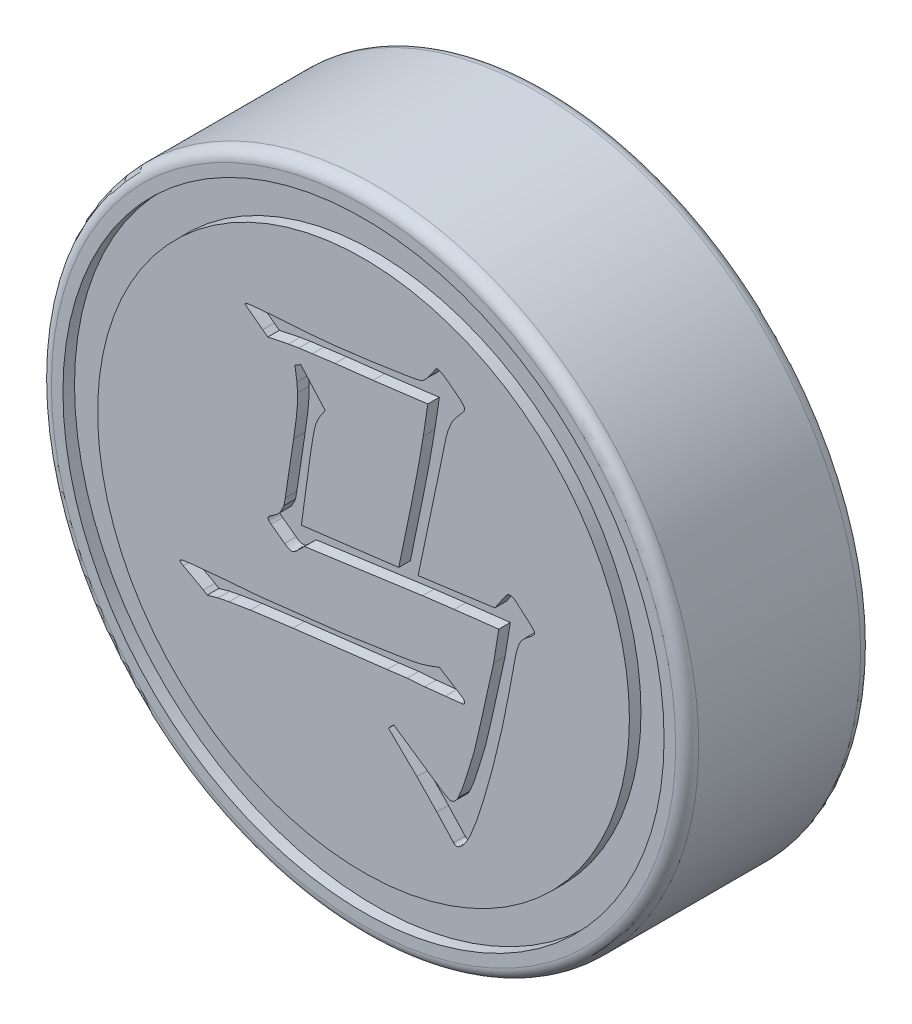
from build123d import *

# Parameters (mm, degrees)
SKETCH_1_R          = 14
EXTRUDE_1_DEPTH     = 8
SKETCH_2_R          = 13
SKETCH_2_R_2        = 11.5
CUT_EXTRUDE_1_DEPTH = 0.5
SKETCH_3_R          = 5.1
CUT_EXTRUDE_2_DEPTH = 5
CHAMFER_1_SIZE      = 0.5
FILLET_1_R          = 0.5
CUT_EXTRUDE_3_DEPTH = 0.5


with BuildPart() as part:
    # 草图1 → 凸台-拉伸1 (new body)
    with BuildSketch(Plane.XY):
        Circle(SKETCH_1_R)
    extrude(amount=EXTRUDE_1_DEPTH)

    # 草图2 → 切除-拉伸1 (cut)
    with BuildSketch(Plane.XY.offset(8)):
        Circle(SKETCH_2_R)
        Circle(SKETCH_2_R_2, mode=Mode.SUBTRACT)
    extrude(amount=-CUT_EXTRUDE_1_DEPTH, mode=Mode.SUBTRACT)

    # 草图3 → 切除-拉伸2 (cut)
    with BuildSketch(Plane(origin=(0, 0, 0), x_dir=(-1, 0, 0), z_dir=(0, 0, -1))):
        Circle(SKETCH_3_R)
    extrude(amount=-CUT_EXTRUDE_2_DEPTH, mode=Mode.SUBTRACT)

    # 倒角1
    chamfer_1_edges = [part.edges().sort_by_distance(p)[0] for p in [
        (5.1, 0, 0),
    ]]
    chamfer(chamfer_1_edges, length=CHAMFER_1_SIZE)

    # 圆角1
    fillet_1_edges = [part.edges().sort_by_distance(p)[0] for p in [
        (-14, 0, 0),
        (-14, 0, 8),
    ]]
    fillet(fillet_1_edges, radius=FILLET_1_R)

    # 草图4 → 切除-拉伸3 (cut)
    with BuildSketch(Plane.XY.offset(8)):
        with BuildLine():
            Line((1.02192811, -3.388258753), (-3.05009405, -3.875793379))
            Line((-3.05009405, -3.875793379), (-4.889429231, -4.119560692))
            Line((-4.889429231, -4.119560692), (-5.811866904, -4.26914518))
            Line((-5.811866904, -4.26914518), (-6.285551114, -4.360557922))
            Line((-6.285551114, -4.360557922), (-6.759235325, -4.493521911))
            Line((-6.759235325, -4.493521911), (-6.928210394, -4.379948504))
            Line((-6.928210394, -4.379948504), (-7.792476322, -3.91180446))
            add(Edge.make_bspline(
                [(-7.792476322, -3.91180446), (-7.824172033, -3.892915726), (-7.874332496, -3.863023113), (-7.941986755, -3.812928981), (-7.92754592, -3.743671449), (-7.860134953, -3.72568963), (-7.777743835, -3.704399275), (-7.656142427, -3.691861261), (-7.488248367, -3.667681472), (-7.270030835, -3.643344867), (-7.00294079, -3.620030117), (-6.687325402, -3.58826599), (-6.32163013, -3.555561773), (-6.061182151, -3.533144655), (-5.922670228, -3.521222742)],
                knots=[0, 0, 0, 0, 0.611781, 0.96818203, 1.194559333, 1.578472039, 1.958946652, 2.601457746, 3.511911509, 4.688574786, 6.115484087, 7.810376802, 9.771866877, 12, 12, 12, 12], degree=3))
            Line((-5.922670228, -3.521222742), (-4.498847513, -3.407649335))
            Line((-4.498847513, -3.407649335), (-3.385274106, -3.277455429))
            Line((-3.385274106, -3.277455429), (-0.928210394, -2.997677036))
            Line((-0.928210394, -2.997677036), (-0.177517873, -2.884103629))
            add(Edge.make_bspline(
                [(-0.177517873, -2.884103629), (-0.002976659, -2.859355952), (0.326844228, -2.812591634), (0.792296954, -2.743770847), (1.200132677, -2.679089227), (1.551111094, -2.624329555), (1.845573951, -2.576664554), (2.083214985, -2.538979277), (2.263557865, -2.506833925), (2.4302683, -2.469309808), (2.606257464, -2.417566126), (2.818816594, -2.352225825), (3.044790218, -2.26724903), (3.201125616, -2.206507502), (3.282315922, -2.174962355)],
                knots=[0, 0, 0, 0, 1.791337178, 3.384990876, 4.781030563, 5.98732094, 6.994598224, 7.812133823, 8.432316449, 8.855683894, 9.547782439, 10.29557961, 11.114836339, 12, 12, 12, 12], degree=3))
            Line((3.282315922, -2.174962355), (4.232454426, -2.773300305))
            add(Edge.make_bspline(
                [(4.232454426, -2.773300305), (4.271524145, -2.800024142), (4.338583314, -2.845892871), (4.376092197, -2.938865362), (4.367253378, -3.000808926), (4.336229229, -3.032922899), (4.289742694, -3.051756492), (4.252983665, -3.052604886), (4.232454426, -3.053078698)],
                knots=[0, 0, 0, 0, 1.952119358, 3.350612848, 3.943943387, 4.465772206, 5.143162068, 6, 6, 6, 6], degree=3))
            Line((4.232454426, -3.053078698), (3.534393484, -3.127870942))
            Line((3.534393484, -3.127870942), (2.642426725, -3.222053767))
            Line((2.642426725, -3.222053767), (1.888964121, -3.277455429))
            Line((1.888964121, -3.277455429), (1.02192811, -3.388258753))
        make_face()
        with BuildLine():
            Line((1.080099855, -5.557233823), (1.301706504, -5.316236593))
            Line((1.301706504, -5.316236593), (2.864033373, -6.379948504))
            add(Edge.make_bspline(
                [(2.864033373, -6.379948504), (2.921232846, -6.420645143), (3.029775317, -6.497871619), (3.184138411, -6.606115645), (3.322348227, -6.698115685), (3.44450176, -6.772047064), (3.546233052, -6.833226302), (3.630160245, -6.880434039), (3.698682589, -6.906876853), (3.765605144, -6.929272156), (3.846166712, -6.918855314), (3.933253227, -6.867195385), (4.018005703, -6.779226826), (4.065015406, -6.704235723), (4.091180188, -6.662496981)],
                knots=[0, 0, 0, 0, 1.690601399, 3.208107423, 4.540290873, 5.688248642, 6.645475806, 7.401535736, 8.000286814, 8.415709317, 9.086148281, 9.872346963, 10.815785381, 12, 12, 12, 12], degree=3))
            add(Edge.make_bspline(
                [(4.091180188, -6.662496981), (4.117627662, -6.60550354), (4.178295318, -6.474766724), (4.265775778, -6.244966076), (4.3640889, -5.958148986), (4.468193231, -5.632404311), (4.569344843, -5.308806316), (4.6586903, -5.026766459), (4.725968492, -4.805352682), (4.76890813, -4.648891954), (4.80181246, -4.523434584), (4.830259269, -4.394371325), (4.873997524, -4.224298078), (4.922523562, -4.011597842), (4.981078932, -3.756839815), (5.0470315, -3.459187473), (5.124780675, -3.120565687), (5.207925826, -2.753077147), (5.289885259, -2.385320588), (5.368076469, -2.044953086), (5.435286584, -1.7450102), (5.489371401, -1.485983217), (5.536778291, -1.268141042), (5.576868413, -1.091322595), (5.603152124, -0.9541783), (5.619275602, -0.876702943), (5.625806227, -0.845322465)],
                knots=[0, 0, 0, 0, 0.750612739, 1.721824789, 2.936128122, 4.373724398, 5.807971754, 6.987489208, 7.909046822, 8.572902297, 8.926151498, 9.458746659, 10.151849687, 11.024345739, 12.065550674, 13.275485001, 14.667344146, 16.217169633, 17.777758605, 19.16961775, 20.390320618, 21.450699861, 22.331528071, 23.054379614, 23.616987649, 24, 24, 24, 24], degree=3))
            Line((5.625806227, -0.845322465), (5.850182958, 0.536949003))
            Line((5.850182958, 0.536949003), (3.924975202, 0.312572272))
            Line((3.924975202, 0.312572272), (2.556554149, 0.143597202))
            Line((2.556554149, 0.143597202), (-2.548709009, -0.565544072))
            Line((-2.548709009, -0.565544072), (-2.908819812, -0.920114709))
            add(Edge.make_bspline(
                [(-2.908819812, -0.920114709), (-2.941890259, -0.948939537), (-3.00586781, -1.004703581), (-3.140264264, -1.023385851), (-3.281555703, -0.980765103), (-3.365867073, -0.918752404), (-3.412974937, -0.884103629)],
                knots=[0, 0, 0, 0, 0.919078809, 1.778034959, 2.758506399, 4, 4, 4, 4], degree=3))
            Line((-3.412974937, -0.884103629), (-3.997462472, -0.454740748))
            add(Edge.make_bspline(
                [(-3.997462472, -0.454740748), (-4.028880439, -0.431307008), (-4.08409245, -0.39012599), (-4.130150416, -0.312795575), (-4.121880376, -0.24586378), (-4.083885947, -0.196489553), (-4.022207428, -0.14619973), (-3.971207955, -0.115147153), (-3.942060809, -0.097400028)],
                knots=[0, 0, 0, 0, 1.441121206, 2.532538105, 3.079035341, 3.812238323, 4.74965357, 6, 6, 6, 6], degree=3))
            add(Edge.make_bspline(
                [(-3.942060809, -0.097400028), (-3.898933282, -0.070622681), (-3.818398472, -0.020619617), (-3.714185048, 0.063741102), (-3.632320197, 0.147021927), (-3.565108397, 0.258807023), (-3.50709492, 0.382699935), (-3.461112743, 0.476062866), (-3.440675768, 0.517558421)],
                knots=[0, 0, 0, 0, 1.123788134, 2.098521925, 2.967174611, 3.693826349, 4.975011237, 6, 6, 6, 6], degree=3))
            Line((-3.440675768, 0.517558421), (-3.385274106, 0.836117978))
            Line((-3.385274106, 0.836117978), (-3.022393219, 3.229469778))
            add(Edge.make_bspline(
                [(-3.022393219, 3.229469778), (-3.00412643, 3.342940479), (-2.970021424, 3.554795926), (-2.933005496, 3.851718927), (-2.900923847, 4.102613135), (-2.875597693, 4.375920415), (-2.85545411, 4.684369894), (-2.854092918, 4.924725476), (-2.85341815, 5.043874211)],
                knots=[0, 0, 0, 0, 1.13380918, 2.116878191, 2.951914959, 3.629057972, 4.82467991, 6, 6, 6, 6], degree=3))
            add(Edge.make_bspline(
                [(-2.85341815, 5.043874211), (-2.857221579, 5.089110723), (-2.864205398, 5.172173558), (-2.872032281, 5.283011949), (-2.878322445, 5.36884719), (-2.880287978, 5.416906942), (-2.881118981, 5.437226011)],
                knots=[0, 0, 0, 0, 1.381352456, 2.536425719, 3.381218889, 4, 4, 4, 4], degree=3))
            Line((-2.881118981, 5.437226011), (-2.966991557, 6.01617338))
            Line((-2.966991557, 6.01617338), (-2.714913995, 6.165757867))
            Line((-2.714913995, 6.165757867), (-1.653972167, 4.969081967))
            add(Edge.make_bspline(
                [(-1.653972167, 4.969081967), (-1.698327178, 4.91158838), (-1.783539262, 4.801135282), (-1.891320703, 4.630740179), (-1.981542932, 4.467955633), (-2.054696531, 4.294917185), (-2.115792442, 4.081378367), (-2.168540935, 3.797720377), (-2.238526564, 3.431222604), (-2.275949519, 3.156770155), (-2.296631447, 3.005093047)],
                knots=[0, 0, 0, 0, 0.829490091, 1.593564684, 2.301893073, 2.954577079, 3.735947138, 4.834958111, 6.250828513, 8, 8, 8, 8], degree=3))
            Line((-2.296631447, 3.005093047), (-2.687213164, 0.162987784))
            Line((-2.687213164, 0.162987784), (1.526083235, 0.68653349))
            add(Edge.make_bspline(
                [(1.526083235, 0.68653349), (1.592693658, 1.004142467), (1.720263216, 1.61241419), (1.901482791, 2.486607057), (2.060665307, 3.283956565), (2.206312311, 4.002576224), (2.328277071, 4.643587807), (2.430014555, 5.207140291), (2.518177454, 5.692163463), (2.563612826, 5.991144106), (2.58425498, 6.126976704)],
                knots=[0, 0, 0, 0, 1.405101977, 2.690993847, 3.865525512, 4.925582518, 5.865717015, 6.690675002, 7.405148728, 8, 8, 8, 8], degree=3))
            Line((2.58425498, 6.126976704), (2.78093088, 7.437226011))
            Line((2.78093088, 7.437226011), (0.409739745, 7.138057036))
            Line((0.409739745, 7.138057036), (-1.235689618, 6.949691385))
            Line((-1.235689618, 6.949691385), (-2.213528954, 6.819497479))
            Line((-2.213528954, 6.819497479), (-2.798016488, 6.744705235))
            Line((-2.798016488, 6.744705235), (-3.243999868, 6.669912992))
            Line((-3.243999868, 6.669912992), (-4.13873671, 6.484317424))
            Line((-4.13873671, 6.484317424), (-4.360343358, 6.65052241))
            Line((-4.360343358, 6.65052241), (-5.086105131, 7.193458698))
            add(Edge.make_bspline(
                [(-5.086105131, 7.193458698), (-5.107085624, 7.206754464), (-5.14904661, 7.233345996), (-5.090169392, 7.278243072), (-5.035762272, 7.294620578), (-4.954600218, 7.306405325), (-4.83807584, 7.319675733), (-4.682542918, 7.336163795), (-4.48892015, 7.356228149), (-4.256881461, 7.374062622), (-3.986541572, 7.397677609), (-3.793428887, 7.410803967), (-3.689983247, 7.417835429)],
                knots=[0, 0, 0, 0, 0.385980643, 0.771961286, 1.042453896, 1.577903022, 2.347501923, 3.372270635, 4.652294289, 6.185997438, 7.956934133, 10, 10, 10, 10], degree=3))
            Line((-3.689983247, 7.417835429), (-2.521008178, 7.492627673))
            Line((-2.521008178, 7.492627673), (-1.29109128, 7.60620108))
            Line((-1.29109128, 7.60620108), (0.326637251, 7.81118723))
            Line((0.326637251, 7.81118723), (1.830792376, 8.035563961))
            add(Edge.make_bspline(
                [(1.830792376, 8.035563961), (1.922292183, 8.049699626), (2.084472188, 8.074754565), (2.295594477, 8.115405254), (2.442015538, 8.151490552), (2.564916912, 8.196692825), (2.671469951, 8.304420672), (2.801570752, 8.448657385), (2.93062949, 8.620330154), (3.025446245, 8.765821), (3.084621283, 8.870931918), (3.130907065, 8.921628432), (3.170456677, 8.957138989), (3.217927265, 8.964210243), (3.26875964, 8.943600288), (3.337894464, 8.913594563), (3.429842405, 8.865684298), (3.496803758, 8.825458382), (3.534393484, 8.802876981)],
                knots=[0, 0, 0, 0, 2.092193509, 3.708335219, 4.851976606, 5.506742034, 6.631386966, 8.197608236, 9.925048467, 11.464360568, 12.13000379, 12.6324408, 13.020506872, 13.294911023, 13.664596551, 14.234415699, 15.008863648, 16, 16, 16, 16], degree=3))
            Line((3.534393484, 8.802876981), (4.14658185, 8.334732936))
            add(Edge.make_bspline(
                [(4.14658185, 8.334732936), (4.179051945, 8.303530404), (4.236948172, 8.247894323), (4.311203468, 8.172293382), (4.354961394, 8.10967395), (4.377474285, 8.047577937), (4.361441098, 7.984578833), (4.336713749, 7.926486278), (4.292656387, 7.879984814), (4.246604137, 7.823929988), (4.182547026, 7.748535793), (4.077511682, 7.632268808), (3.958052189, 7.484909557), (3.832861963, 7.309795093), (3.744244128, 7.109120221), (3.666947933, 6.916181712), (3.603442122, 6.71582), (3.5552504, 6.51457542), (3.502550708, 6.270752784), (3.46927638, 6.09291007), (3.451290991, 5.996782798)],
                knots=[0, 0, 0, 0, 0.913372323, 1.628600438, 2.142589436, 2.456366583, 2.930277993, 3.407504797, 3.726267242, 4.217602308, 4.881511177, 5.730261017, 7.393670676, 8.727937683, 10.075920656, 11.824361196, 12.943244151, 14.332445243, 16.017618892, 18, 18, 18, 18], degree=3))
            Line((3.451290991, 5.996782798), (2.362648332, 0.800106898))
            Line((2.362648332, 0.800106898), (5.681207889, 1.24886036))
            Line((5.681207889, 1.24886036), (6.127191268, 1.902599972))
            add(Edge.make_bspline(
                [(6.127191268, 1.902599972), (6.153835189, 1.939578767), (6.20216321, 2.006652678), (6.314029736, 2.063750447), (6.437876091, 2.046708727), (6.50737744, 2.00193463), (6.545473817, 1.977392216)],
                knots=[0, 0, 0, 0, 1.101176936, 1.997367549, 2.902279733, 4, 4, 4, 4], degree=3))
            Line((6.545473817, 1.977392216), (7.160432265, 1.45384651))
            add(Edge.make_bspline(
                [(7.160432265, 1.45384651), (7.196766128, 1.4199862), (7.260835343, 1.360278718), (7.340123047, 1.279062057), (7.387710413, 1.213334242), (7.402427322, 1.14307921), (7.364740755, 1.07082719), (7.322378885, 1.028510507), (7.29893642, 1.005093047)],
                knots=[0, 0, 0, 0, 1.568533263, 2.765868753, 3.591642496, 4.095320452, 4.945977049, 6, 6, 6, 6], degree=3))
            Line((7.29893642, 1.005093047), (6.963756365, 0.741935152))
            add(Edge.make_bspline(
                [(6.963756365, 0.741935152), (6.929681462, 0.705743424), (6.863807968, 0.635777688), (6.775935707, 0.514063463), (6.703481798, 0.355219779), (6.638340751, 0.159100516), (6.584080503, -0.056256652), (6.553578555, -0.222772476), (6.532151567, -0.344792669), (6.516344822, -0.444818896), (6.490064822, -0.580151565), (6.460754722, -0.752270957), (6.421829806, -0.959091537), (6.37346015, -1.201510143), (6.321738312, -1.479620263), (6.202845204, -2.125033946), (5.996092787, -3.132594788), (5.728599452, -4.253516431), (5.497792667, -5.139614673), (5.320782371, -5.771394444), (5.141103982, -6.366015117), (4.98902586, -6.83524836), (4.871308115, -7.184903317), (4.781508578, -7.416554562), (4.698592367, -7.625709859), (4.619612165, -7.811547466), (4.539686175, -7.972359651), (4.460843338, -8.107861923), (4.391273071, -8.223876528), (4.300410312, -8.33392912), (4.199335902, -8.43095734), (4.086151001, -8.505308377), (3.968202968, -8.512238661), (3.92105279, -8.462968036), (3.897274371, -8.438120249)],
                knots=[0, 0, 0, 0, 0.476822832, 0.921792396, 1.433020431, 2.144733505, 2.903328113, 3.561931418, 3.768781651, 4.092159209, 4.533585964, 5.09151551, 5.76753087, 6.552972248, 7.463578957, 8.481957343, 12.850547583, 17.331477306, 19.538611084, 21.636882995, 23.627044628, 25.49881145, 26.370253191, 27.166712229, 27.882440253, 28.529316745, 29.103883858, 29.603932766, 30.034100226, 30.399427609, 30.969880823, 31.374369736, 31.684486903, 32, 32, 32, 32], degree=3))
            Line((3.897274371, -8.438120249), (3.171512598, -7.651416648))
            Line((3.171512598, -7.651416648), (2.30724667, -6.753909723))
            Line((2.30724667, -6.753909723), (1.080099855, -5.557233823))
        make_face()
    extrude(amount=-CUT_EXTRUDE_3_DEPTH, mode=Mode.SUBTRACT)


solid = part.part
